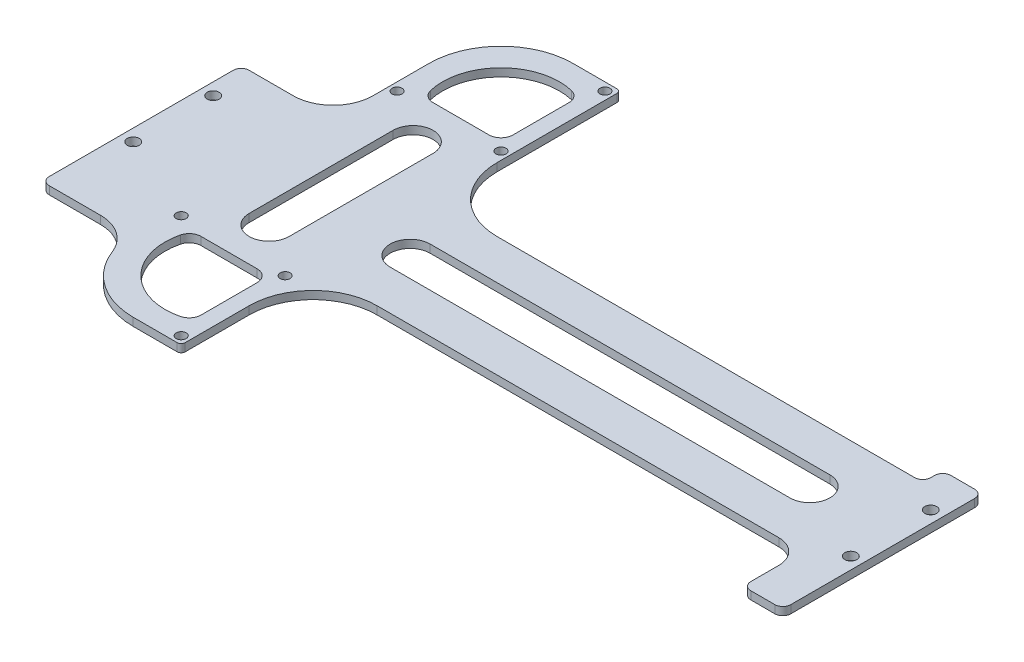
from build123d import *

# Parameters (mm, degrees)
SKETCH_1_W          = 30
SKETCH_1_H          = 110
SKETCH_1_R          = 1.25
EXTRUDE_1_DEPTH     = 2
FILLET_1_R          = 1
FILLET_2_R          = 18
SKETCH_2_W          = 23
SKETCH_2_H          = 50
EXTRUDE_2_DEPTH     = 2
SKETCH_3_W          = 132.5
SKETCH_3_H          = 30
EXTRUDE_3_DEPTH     = 2
FILLET_3_R          = 16
SKETCH_4_W          = 10
SKETCH_4_H          = 50
EXTRUDE_4_DEPTH     = 2
FILLET_5_R          = 6
FILLET_6_R          = 2
FILLET_7_R          = 2
CUT_EXTRUDE_1_DEPTH = 10
CUT_EXTRUDE_2_DEPTH = 10
FILLET_9_R          = 10
CUT_EXTRUDE_3_DEPTH = 10
FILLET_10_R         = 3
SKETCH_8_R          = 1.5
CUT_EXTRUDE_4_DEPTH = 10


with BuildPart() as part:
    # 草图1 → 凸台-拉伸1 (new body)
    with BuildSketch(Plane(origin=(0, 0, 0), x_dir=(1, 0, 0), z_dir=(0, 1, 0))):
        Rectangle(SKETCH_1_W, SKETCH_1_H)
        with Locations(Location((13, 27, 0), (0, 0, 270))):
            Circle(SKETCH_1_R, mode=Mode.SUBTRACT)
        with Locations(Location((-13, 27, 0), (0, 0, 90))):
            Circle(SKETCH_1_R, mode=Mode.SUBTRACT)
        with Locations(Location((-13, -27, 0), (0, 0, 270))):
            Circle(SKETCH_1_R, mode=Mode.SUBTRACT)
        with Locations(Location((13, -27, 0), (0, 0, 90))):
            Circle(SKETCH_1_R, mode=Mode.SUBTRACT)
        with Locations(Location((13, 53, 0), (0, 0, 270))):
            Circle(SKETCH_1_R, mode=Mode.SUBTRACT)
        with Locations(Location((13, -53, 0), (0, 0, 90))):
            Circle(SKETCH_1_R, mode=Mode.SUBTRACT)
    extrude(amount=EXTRUDE_1_DEPTH)

    # 圆角1
    fillet_1_edges = [part.edges().sort_by_distance(p)[0] for p in [
        (15, 1, 55),
        (15, 1, -55),
    ]]
    fillet(fillet_1_edges, radius=FILLET_1_R)

    # 圆角2
    fillet_2_edges = [part.edges().sort_by_distance(p)[0] for p in [
        (-15, 1, 55),
        (-15, 1, -55),
    ]]
    fillet(fillet_2_edges, radius=FILLET_2_R)

    # 草图2 → 凸台-拉伸2 (add)
    with BuildSketch(Plane(origin=(0, 2, 0), x_dir=(1, 0, 0), z_dir=(0, 1, 0))):
        with Locations((-26.5, -12)):
            Rectangle(SKETCH_2_W, SKETCH_2_H)
    extrude(amount=-EXTRUDE_2_DEPTH)

    # 草图3 → 凸台-拉伸3 (add)
    with BuildSketch(Plane(origin=(0, 2, 0), x_dir=(1, 0, 0), z_dir=(0, 1, 0))):
        with Locations((81.25, -7)):
            Rectangle(SKETCH_3_W, SKETCH_3_H)
    extrude(amount=-EXTRUDE_3_DEPTH)

    # 圆角3
    fillet_3_edges = [part.edges().sort_by_distance(p)[0] for p in [
        (15, 1, 22),
        (15, 1, -8),
    ]]
    fillet(fillet_3_edges, radius=FILLET_3_R)

    # 草图4 → 凸台-拉伸4 (add)
    with BuildSketch(Plane.XZ):
        with Locations((142.5, 12)):
            Rectangle(SKETCH_4_W, SKETCH_4_H)
    extrude(amount=-EXTRUDE_4_DEPTH)

    # 圆角5
    fillet_5_edges = [part.edges().sort_by_distance(p)[0] for p in [
        (137.5, 1, 22),
    ]]
    fillet(fillet_5_edges, radius=FILLET_5_R)

    # 圆角6
    fillet_6_edges = [part.edges().sort_by_distance(p)[0] for p in [
        (137.5, 1, -8),
    ]]
    fillet(fillet_6_edges, radius=FILLET_6_R)

    # 圆角7
    fillet_7_edges = [part.edges().sort_by_distance(p)[0] for p in [
        (147.5, 1, 37),
        (137.5, 1, -13),
        (137.5, 1, 37),
        (147.5, 1, -13),
        (-38, 1, 37),
        (-38, 1, -13),
    ]]
    fillet(fillet_7_edges, radius=FILLET_7_R)

    # 草图5 → 切除-拉伸1 (cut)
    with BuildSketch(Plane.XZ):
        with BuildLine():
            Line((-8.171572875, 29), (11, 29))
            Line((11, 29), (11, 48.171572875))
            ThreePointArc((11, 48.171572875), (-5.055430247, 45.055430247), (-8.171572875, 29))
        make_face()
        with BuildLine():
            Line((11, -29), (11, -48.171572875))
            ThreePointArc((11, -48.171572875), (-5.055430247, -45.055430247), (-8.171572875, -29))
            Line((-8.171572875, -29), (11, -29))
        make_face()
    extrude(amount=-CUT_EXTRUDE_1_DEPTH, mode=Mode.SUBTRACT)

    # 草图6 → 切除-拉伸2 (cut)
    with BuildSketch(Plane.XZ):
        with BuildLine():
            Line((-5, -18), (-5, 18))
            ThreePointArc((-5, 18), (0, 23), (5, 18))
            Line((5, 18), (5, -18))
            ThreePointArc((5, -18), (0, -23), (-5, -18))
        make_face()
    extrude(amount=-CUT_EXTRUDE_2_DEPTH, mode=Mode.SUBTRACT)

    # 圆角9
    fillet_9_edges = [part.edges().sort_by_distance(p)[0] for p in [
        (-15, 1, 37),
        (-15, 1, -13),
    ]]
    fillet(fillet_9_edges, radius=FILLET_9_R)

    # 草图7 → 切除-拉伸3 (cut)
    with BuildSketch(Plane.XZ):
        with BuildLine():
            Line((24.271968642, 12), (124.271968642, 12))
            ThreePointArc((124.271968642, 12), (129.271968642, 7), (124.271968642, 2))
            Line((124.271968642, 2), (24.271968642, 2))
            ThreePointArc((24.271968642, 2), (19.271968642, 7), (24.271968642, 12))
        make_face()
    extrude(amount=-CUT_EXTRUDE_3_DEPTH, mode=Mode.SUBTRACT)

    # 圆角10
    fillet_10_edges = [part.edges().sort_by_distance(p)[0] for p in [
        (-8.171572875, 1, 29),
        (11, 1, 48.171572875),
        (11, 1, 29),
        (11, 1, -48.171572875),
        (-8.171572875, 1, -29),
        (11, 1, -29),
    ]]
    fillet(fillet_10_edges, radius=FILLET_10_R)

    # 草图8 → 切除-拉伸4 (cut)
    with BuildSketch(Plane.XZ):
        with Locations(Location((-35, 17, 0), (0, 0, 270))):
            Circle(SKETCH_8_R)
        with Locations(Location((-35, -3, 0), (0, 0, 270))):
            Circle(SKETCH_8_R)
        with Locations(Location((144.5, 17, 0), (0, 0, 270))):
            Circle(SKETCH_8_R)
        with Locations(Location((144.5, -3, 0), (0, 0, 270))):
            Circle(SKETCH_8_R)
    extrude(amount=-CUT_EXTRUDE_4_DEPTH, mode=Mode.SUBTRACT)


solid = part.part
